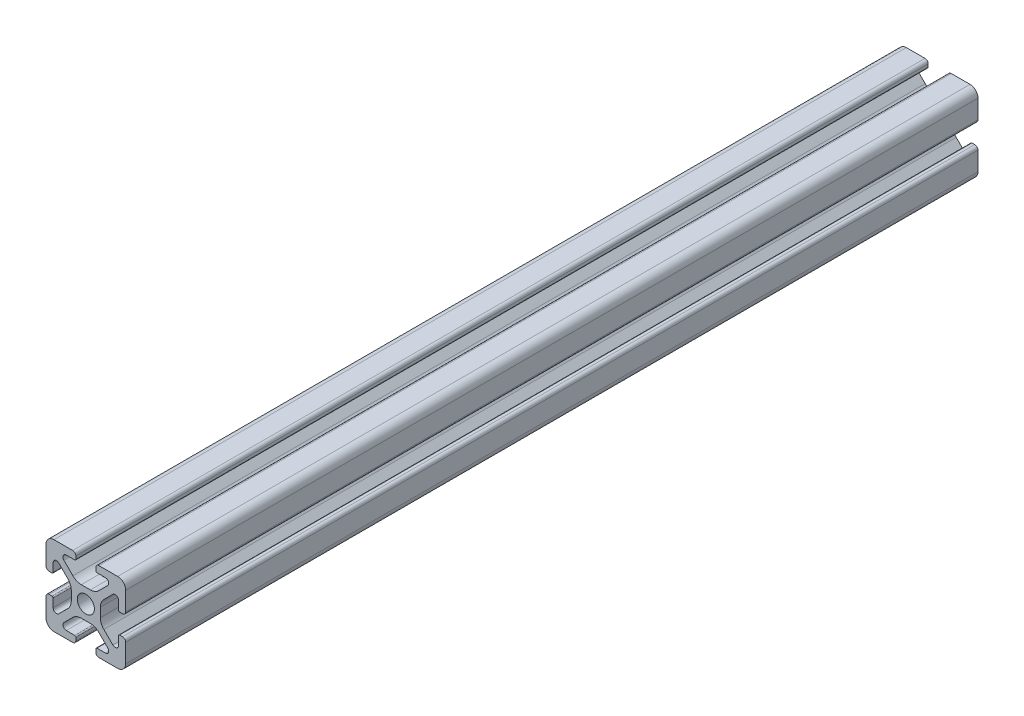
from build123d import *

# Parameters (mm, degrees)
ESQUISSE1_R       = 2.15
EXTRUSION1_DEPTH  = 214
TROU_TARAUD_M61_D = 5
TROU_TARAUD_M51_D = 4.2


with BuildPart() as part:
    # Esquisse1 → Extrusion1 (new body)
    with BuildSketch(Plane(origin=(0, 0, 0), x_dir=(-1, 0, 0), z_dir=(0, 0, -1))):
        with BuildLine():
            Line((-18, 0), (-13.3, 0))
            ThreePointArc((-13.3, 0), (-12.734314575, 0.234314575), (-12.5, 0.8))
            Line((-12.5, 0.8), (-12.5, 1.5))
            ThreePointArc((-12.5, 1.5), (-12.587867966, 1.712132034), (-12.8, 1.8))
            Line((-12.8, 1.8), (-14.918424061, 1.8))
            ThreePointArc((-14.918424061, 1.8), (-15.686700051, 2.313345604), (-15.506437047, 3.219588924))
            Line((-15.506437047, 3.219588924), (-13.254705627, 5.471320344))
            ThreePointArc((-13.254705627, 5.471320344), (-12.281435581, 6.121638598), (-11.133385284, 6.35))
            Line((-11.133385284, 6.35), (-8.866614716, 6.35))
            ThreePointArc((-8.866614716, 6.35), (-7.718564419, 6.121638598), (-6.745294373, 5.471320344))
            Line((-6.745294373, 5.471320344), (-4.493562953, 3.219588924))
            ThreePointArc((-4.493562953, 3.219588924), (-4.313299949, 2.313345604), (-5.081575939, 1.8))
            Line((-5.081575939, 1.8), (-7.2, 1.8))
            ThreePointArc((-7.2, 1.8), (-7.412132034, 1.712132034), (-7.5, 1.5))
            Line((-7.5, 1.5), (-7.5, 0.8))
            ThreePointArc((-7.5, 0.8), (-7.265685425, 0.234314575), (-6.7, 0))
            Line((-6.7, 0), (-2, 0))
            ThreePointArc((-2, 0), (-0.585786438, 0.585786438), (0, 2))
            Line((0, 2), (0, 6.7))
            ThreePointArc((0, 6.7), (-0.234314575, 7.265685425), (-0.8, 7.5))
            Line((-0.8, 7.5), (-1.5, 7.5))
            ThreePointArc((-1.5, 7.5), (-1.712132034, 7.412132034), (-1.8, 7.2))
            Line((-1.8, 7.2), (-1.8, 5.081575939))
            ThreePointArc((-1.8, 5.081575939), (-2.313345604, 4.313299949), (-3.219588924, 4.493562953))
            Line((-3.219588924, 4.493562953), (-5.471320344, 6.745294373))
            ThreePointArc((-5.471320344, 6.745294373), (-6.121638598, 7.718564419), (-6.35, 8.866614716))
            Line((-6.35, 8.866614716), (-6.35, 11.133385284))
            ThreePointArc((-6.35, 11.133385284), (-6.121638598, 12.281435581), (-5.471320344, 13.254705627))
            Line((-5.471320344, 13.254705627), (-3.219588924, 15.506437047))
            ThreePointArc((-3.219588924, 15.506437047), (-2.313345604, 15.686700051), (-1.8, 14.918424061))
            Line((-1.8, 14.918424061), (-1.8, 12.8))
            ThreePointArc((-1.8, 12.8), (-1.712132034, 12.587867966), (-1.5, 12.5))
            Line((-1.5, 12.5), (-0.8, 12.5))
            ThreePointArc((-0.8, 12.5), (-0.234314575, 12.734314575), (0, 13.3))
            Line((0, 13.3), (0, 18))
            ThreePointArc((0, 18), (-0.585786438, 19.414213562), (-2, 20))
            Line((-2, 20), (-6.7, 20))
            ThreePointArc((-6.7, 20), (-7.265685425, 19.765685425), (-7.5, 19.2))
            Line((-7.5, 19.2), (-7.5, 18.5))
            ThreePointArc((-7.5, 18.5), (-7.412132034, 18.287867966), (-7.2, 18.2))
            Line((-7.2, 18.2), (-5.081575939, 18.2))
            ThreePointArc((-5.081575939, 18.2), (-4.313299949, 17.686654396), (-4.493562953, 16.780411076))
            Line((-4.493562953, 16.780411076), (-6.745294373, 14.528679656))
            ThreePointArc((-6.745294373, 14.528679656), (-7.718564419, 13.878361402), (-8.866614716, 13.65))
            Line((-8.866614716, 13.65), (-11.133385284, 13.65))
            ThreePointArc((-11.133385284, 13.65), (-12.281435581, 13.878361402), (-13.254705627, 14.528679656))
            Line((-13.254705627, 14.528679656), (-15.506437047, 16.780411076))
            ThreePointArc((-15.506437047, 16.780411076), (-15.686700051, 17.686654396), (-14.918424061, 18.2))
            Line((-14.918424061, 18.2), (-12.8, 18.2))
            ThreePointArc((-12.8, 18.2), (-12.587867966, 18.287867966), (-12.5, 18.5))
            Line((-12.5, 18.5), (-12.5, 19.2))
            ThreePointArc((-12.5, 19.2), (-12.734314575, 19.765685425), (-13.3, 20))
            Line((-13.3, 20), (-18, 20))
            ThreePointArc((-18, 20), (-19.414213562, 19.414213562), (-20, 18))
            Line((-20, 18), (-20, 13.3))
            ThreePointArc((-20, 13.3), (-19.765685425, 12.734314575), (-19.2, 12.5))
            Line((-19.2, 12.5), (-18.5, 12.5))
            ThreePointArc((-18.5, 12.5), (-18.287867966, 12.587867966), (-18.2, 12.8))
            Line((-18.2, 12.8), (-18.2, 14.918424061))
            ThreePointArc((-18.2, 14.918424061), (-17.686654396, 15.686700051), (-16.780411076, 15.506437047))
            Line((-16.780411076, 15.506437047), (-14.528679656, 13.254705627))
            ThreePointArc((-14.528679656, 13.254705627), (-13.878361402, 12.281435581), (-13.65, 11.133385284))
            Line((-13.65, 11.133385284), (-13.65, 8.866614716))
            ThreePointArc((-13.65, 8.866614716), (-13.878361402, 7.718564419), (-14.528679656, 6.745294373))
            Line((-14.528679656, 6.745294373), (-16.780411076, 4.493562953))
            ThreePointArc((-16.780411076, 4.493562953), (-17.686654396, 4.313299949), (-18.2, 5.081575939))
            Line((-18.2, 5.081575939), (-18.2, 7.2))
            ThreePointArc((-18.2, 7.2), (-18.287867966, 7.412132034), (-18.5, 7.5))
            Line((-18.5, 7.5), (-19.2, 7.5))
            ThreePointArc((-19.2, 7.5), (-19.765685425, 7.265685425), (-20, 6.7))
            Line((-20, 6.7), (-20, 2))
            ThreePointArc((-20, 2), (-19.414213562, 0.585786438), (-18, 0))
        make_face()
        with Locations(Location((-10, 10, 0), (0, 0, 180))):
            Circle(ESQUISSE1_R, mode=Mode.SUBTRACT)
    extrude(amount=-EXTRUSION1_DEPTH)

    # Trou taraudé M61 (through all)
    with Locations(Plane(origin=(0, 0, 0), x_dir=(-1, 0, 0), z_dir=(0, -1, 0))):
        with Locations((-10, -207)):
            Hole(TROU_TARAUD_M61_D / 2)

    # Trou taraudé M51 (through all)
    with Locations(Plane(origin=(0, 0, 0), x_dir=(-1, 0, 0), z_dir=(0, -1, 0))):
        with Locations((-10, -10), (455.3, -207)):
            Hole(TROU_TARAUD_M51_D / 2)


solid = part.part
